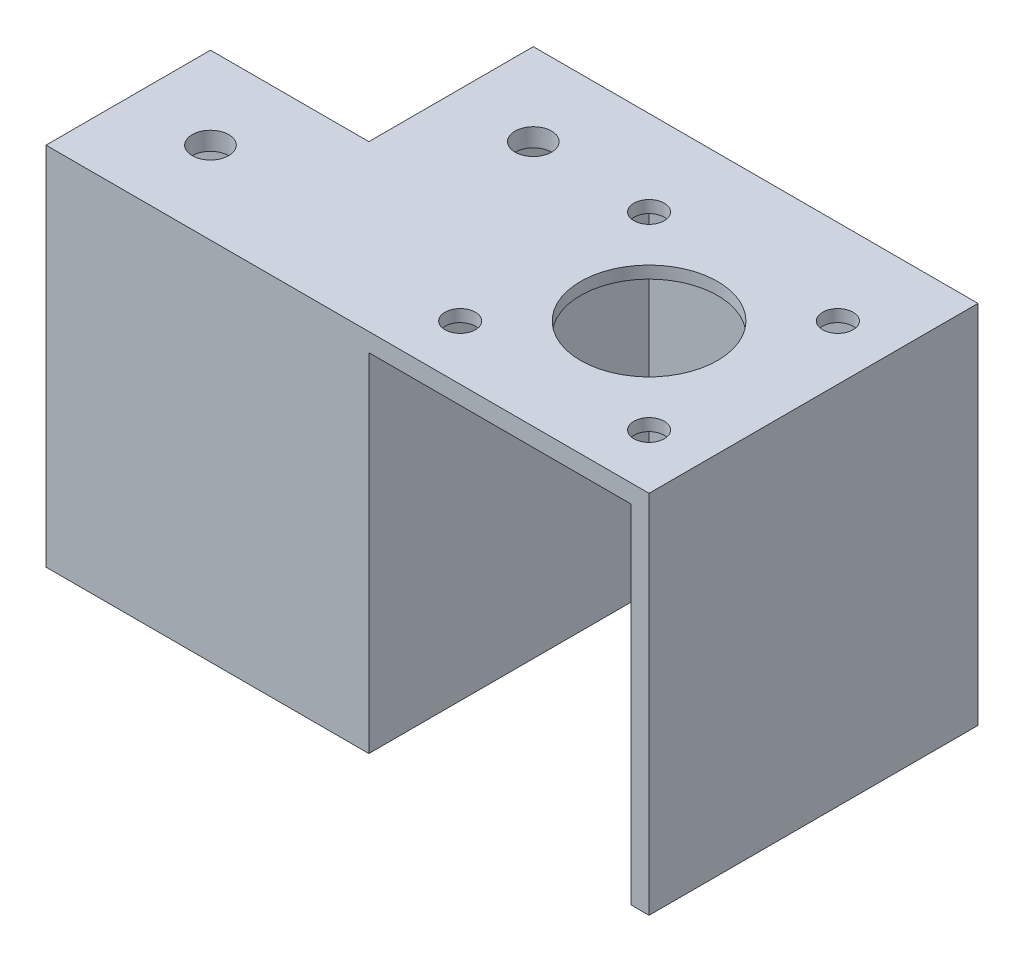
from build123d import *

# Parameters (mm, degrees)
SKETCH1_R           = 2.5
SKETCH1_R_2         = 11.25
BOSS_EXTRUDE1_DEPTH = 60
SKETCH2_W           = 43
SKETCH2_H           = 43
CUT_EXTRUDE1_DEPTH  = 58
SKETCH3_W           = 21
SKETCH3_H           = 21
CUT_EXTRUDE2_DEPTH  = 51
SKETCH4_W           = 21
SKETCH4_H           = 21
CUT_EXTRUDE3_DEPTH  = 50
CUT_EXTRUDE5_REACH  = 100.991
SKETCH6_R           = 3
CUT_EXTRUDE6_REACH  = 102.102
SKETCH7_R           = 3
CUT_EXTRUDE7_REACH  = 101.394
SKETCH8_R           = 3
CUT_EXTRUDE8_REACH  = 102.102
SKETCH9_R           = 3
CUT_EXTRUDE9_REACH  = 149.541
SKETCH10_W          = 43
SKETCH10_H          = 57


with BuildPart() as part:
    # Sketch1 → Boss-Extrude1 (new body)
    with BuildSketch(Plane(origin=(0, 0, 0), x_dir=(1, 0, 0), z_dir=(0, 1, 0))):
        Polygon((-24.5, 29.5), (48.5, 29.5), (48.5, 2.5), (74.5, 2.5), (74.5, -24.5), (48.5, -24.5), (-24.5, -24.5), align=None)
        with Locations(Location((15.5, 15.5, 0), (0, 0, 270))):
            Circle(SKETCH1_R, mode=Mode.SUBTRACT)
        with Locations(Location((-15.5, 15.5, 0), (0, 0, 270))):
            Circle(SKETCH1_R, mode=Mode.SUBTRACT)
        with Locations(Location((15.5, -15.5, 0), (0, 0, 270))):
            Circle(SKETCH1_R, mode=Mode.SUBTRACT)
        with Locations(Location((-15.5, -15.5, 0), (0, 0, 270))):
            Circle(SKETCH1_R, mode=Mode.SUBTRACT)
        with Locations(Location((0, 0, 0), (0, 0, 270))):
            Circle(SKETCH1_R_2, mode=Mode.SUBTRACT)
    extrude(amount=-BOSS_EXTRUDE1_DEPTH)

    # Sketch2 → Cut-Extrude1 (cut)
    with BuildSketch(Plane.XZ.offset(60)):
        Rectangle(SKETCH2_W, SKETCH2_H)
    extrude(amount=-CUT_EXTRUDE1_DEPTH, mode=Mode.SUBTRACT)

    # Sketch3 → Cut-Extrude2 (cut)
    with BuildSketch(Plane(origin=(0, 0, -29.5), x_dir=(-1, 0, 0), z_dir=(0, 0, -1))):
        with Locations((-35, -13.5)):
            Rectangle(SKETCH3_W, SKETCH3_H)
    extrude(amount=-CUT_EXTRUDE2_DEPTH, mode=Mode.SUBTRACT)

    # Sketch4 → Cut-Extrude3 (cut)
    with BuildSketch(Plane(origin=(74.5, 0, 0), x_dir=(0, 0, -1), z_dir=(1, 0, 0))):
        with Locations((-11, -13.5)):
            Rectangle(SKETCH4_W, SKETCH4_H)
    extrude(amount=-CUT_EXTRUDE3_DEPTH, mode=Mode.SUBTRACT)

    # Sketch6 → Cut-Extrude5 (cut, up to next)
    with BuildSketch(Plane(origin=(48.5, 0, 0), x_dir=(0, 0, -1), z_dir=(1, 0, 0)), mode=Mode.PRIVATE) as cut_extrude5_sk1:
        with Locations((16, -13.5)):
            Circle(SKETCH6_R)
    cut_extrude5_tool1 = extrude(cut_extrude5_sk1.sketch, amount=-CUT_EXTRUDE5_REACH, mode=Mode.PRIVATE) & part.part
    add(cut_extrude5_tool1.solids().sort_by_distance((48.5, -13.5, -16))[0], mode=Mode.SUBTRACT)

    # Sketch7 → Cut-Extrude6 (cut, up to next)
    with BuildSketch(Plane(origin=(0, 0, 0), x_dir=(1, 0, 0), z_dir=(0, 1, 0)), mode=Mode.PRIVATE) as cut_extrude6_sk1:
        with Locations(Location((35, 16, 0), (0, 0, 270))):
            Circle(SKETCH7_R)
    cut_extrude6_tool1 = extrude(cut_extrude6_sk1.sketch, amount=-CUT_EXTRUDE6_REACH, mode=Mode.PRIVATE) & part.part
    add(cut_extrude6_tool1.solids().sort_by_distance((35, 0, -16))[0], mode=Mode.SUBTRACT)

    # Sketch8 → Cut-Extrude7 (cut, up to next)
    with BuildSketch(Plane(origin=(0, 0, -2.5), x_dir=(-1, 0, 0), z_dir=(0, 0, -1)), mode=Mode.PRIVATE) as cut_extrude7_sk1:
        with Locations((-61, -13.5)):
            Circle(SKETCH8_R)
    cut_extrude7_tool1 = extrude(cut_extrude7_sk1.sketch, amount=-CUT_EXTRUDE7_REACH, mode=Mode.PRIVATE) & part.part
    add(cut_extrude7_tool1.solids().sort_by_distance((61, -13.5, -2.5))[0], mode=Mode.SUBTRACT)

    # Sketch9 → Cut-Extrude8 (cut, up to next)
    with BuildSketch(Plane(origin=(0, 0, 0), x_dir=(1, 0, 0), z_dir=(0, 1, 0)), mode=Mode.PRIVATE) as cut_extrude8_sk1:
        with Locations(Location((61, -11, 0), (0, 0, 270))):
            Circle(SKETCH9_R)
    cut_extrude8_tool1 = extrude(cut_extrude8_sk1.sketch, amount=-CUT_EXTRUDE8_REACH, mode=Mode.PRIVATE) & part.part
    add(cut_extrude8_tool1.solids().sort_by_distance((61, 0, 11))[0], mode=Mode.SUBTRACT)


with BuildPart() as body_2:
    # Mirror3: mirrored copy
    add(part.part.mirror(Plane(origin=(-24.5, -60, 0), x_dir=(0, 0, 1), z_dir=(-1, 0, 0))))

    # Sketch10 → Cut-Extrude9 (cut, up to next)
    with BuildSketch(Plane.XY.offset(24.5), mode=Mode.PRIVATE) as cut_extrude9_sk1:
        with Locations((-49, -31.5)):
            Rectangle(SKETCH10_W, SKETCH10_H)
    cut_extrude9_tool1 = extrude(cut_extrude9_sk1.sketch, amount=-CUT_EXTRUDE9_REACH, mode=Mode.PRIVATE) & body_2.part
    add(cut_extrude9_tool1.solids().sort_by_distance((-49, -31.5, 24.5))[0], mode=Mode.SUBTRACT)


solid = body_2.part
